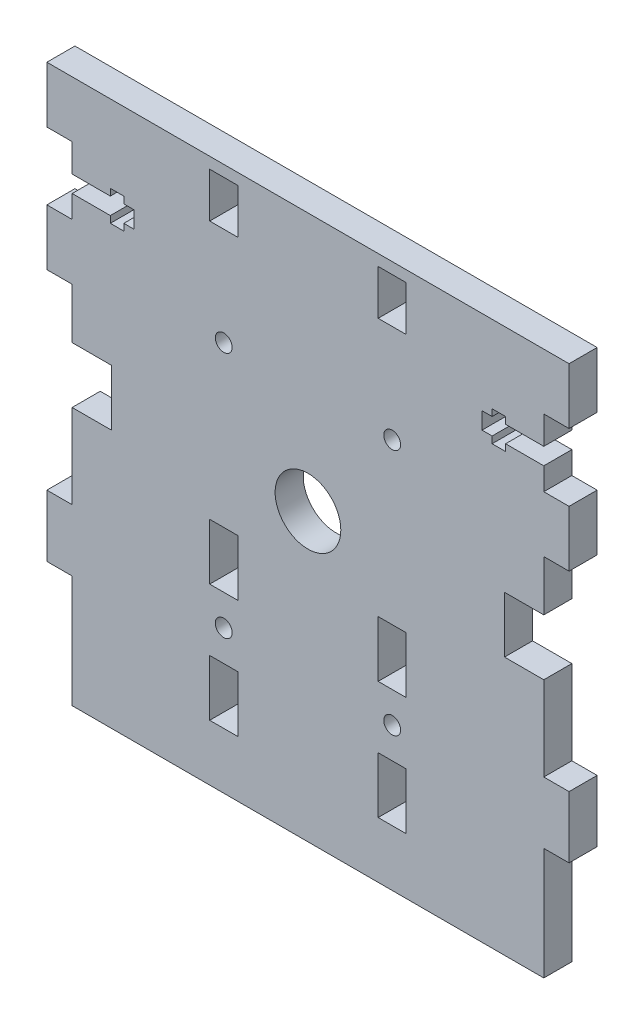
from build123d import *

# Parameters (mm, degrees)
MODEL_R                  = 1.500000022
MODEL_R_2                = 5.85
MODEL_W                  = 5.000000237
MODEL_H                  = 10
MODEL_H_2                = 8.000000671
RESSALTO_EXTRUS_O1_DEPTH = 5


with BuildPart() as part:
    # Model → Ressalto-extrusão1 (new body)
    with BuildSketch(Plane.XY):
        Polygon((-85.499999911, 109.000001535), (-85.499999911, 119.000001535), (-80.999999874, 119.000001535), (-80.999999874, 123.000001432), (-74.199999284, 123.000001432), (-74.199999284, 121.80000149), (-71.799999703, 121.80000149), (-71.799999703, 123.000001432), (-69.999999218, 123.000001432), (-69.999999218, 126.000001536), (-71.799999703, 126.000001536), (-71.799999703, 127.200001477), (-74.199999284, 127.200001477), (-74.199999284, 126.000001536), (-80.999999874, 126.000001536), (-80.999999874, 131.000001773), (-85.499999911, 131.000001773), (-85.499999911, 141.000001773), (7.500000924, 141.000001773), (7.500000924, 131.000001773), (3.000000887, 131.000001773), (3.000000887, 126.000001536), (-3.799999703, 126.000001536), (-3.799999703, 127.200001477), (-6.199999284, 127.200001477), (-6.199999284, 126.000001536), (-7.999999768, 126.000001536), (-7.999999768, 123.000001432), (-6.199999284, 123.000001432), (-6.199999284, 121.80000149), (-3.799999703, 121.80000149), (-3.799999703, 123.000001432), (3.000000887, 123.000001432), (3.000000887, 119.000001535), (7.500000924, 119.000001535), (7.500000924, 109.000001535), (3.000000887, 109.000001535), (3.000000887, 100.000001104), (-3.999999248, 100.000001104), (-3.999999248, 90.000001104), (3.000000887, 90.000001104), (3.000000887, 75.000001296), (7.500000924, 75.000001296), (7.500000924, 64.000001177), (3.000000887, 64.000001177), (3.000000887, 63.000001432), (3.000000887, 44.000000821), (-80.999999874, 44.000000821), (-80.999999874, 63.000001432), (-80.999999874, 64.000001177), (-85.499999911, 64.000001177), (-85.499999911, 75.000001296), (-80.999999874, 75.000001296), (-80.999999874, 90.000001104), (-73.999999739, 90.000001104), (-73.999999739, 100.000001104), (-80.999999874, 100.000001104), (-80.999999874, 109.000001535), align=None)
        with Locations((-24.000000328, 113.500001691)):
            Circle(MODEL_R, mode=Mode.SUBTRACT)
        with Locations((-24.000000328, 69.500001036)):
            Circle(MODEL_R, mode=Mode.SUBTRACT)
        with Locations((-54.000000775, 113.500001691)):
            Circle(MODEL_R, mode=Mode.SUBTRACT)
        with Locations((-54.000000775, 69.500001036)):
            Circle(MODEL_R, mode=Mode.SUBTRACT)
        with Locations((-38.999999493, 95.000001416)):
            Circle(MODEL_R_2, mode=Mode.SUBTRACT)
        with Locations((-53.999999882, 59.000001177)):
            Rectangle(MODEL_W, MODEL_H, mode=Mode.SUBTRACT)
        with Locations((-24.000000119, 80.000001296)):
            Rectangle(MODEL_W, MODEL_H, mode=Mode.SUBTRACT)
        with Locations((-53.999999882, 135.000002109)):
            Rectangle(MODEL_W, MODEL_H_2, mode=Mode.SUBTRACT)
        with Locations((-24.000000119, 135.000002109)):
            Rectangle(MODEL_W, MODEL_H_2, mode=Mode.SUBTRACT)
        with Locations((-24.000000119, 59.000001177)):
            Rectangle(MODEL_W, MODEL_H, mode=Mode.SUBTRACT)
        with Locations((-53.999999882, 80.000001296)):
            Rectangle(MODEL_W, MODEL_H, mode=Mode.SUBTRACT)
    extrude(amount=RESSALTO_EXTRUS_O1_DEPTH)


solid = part.part
